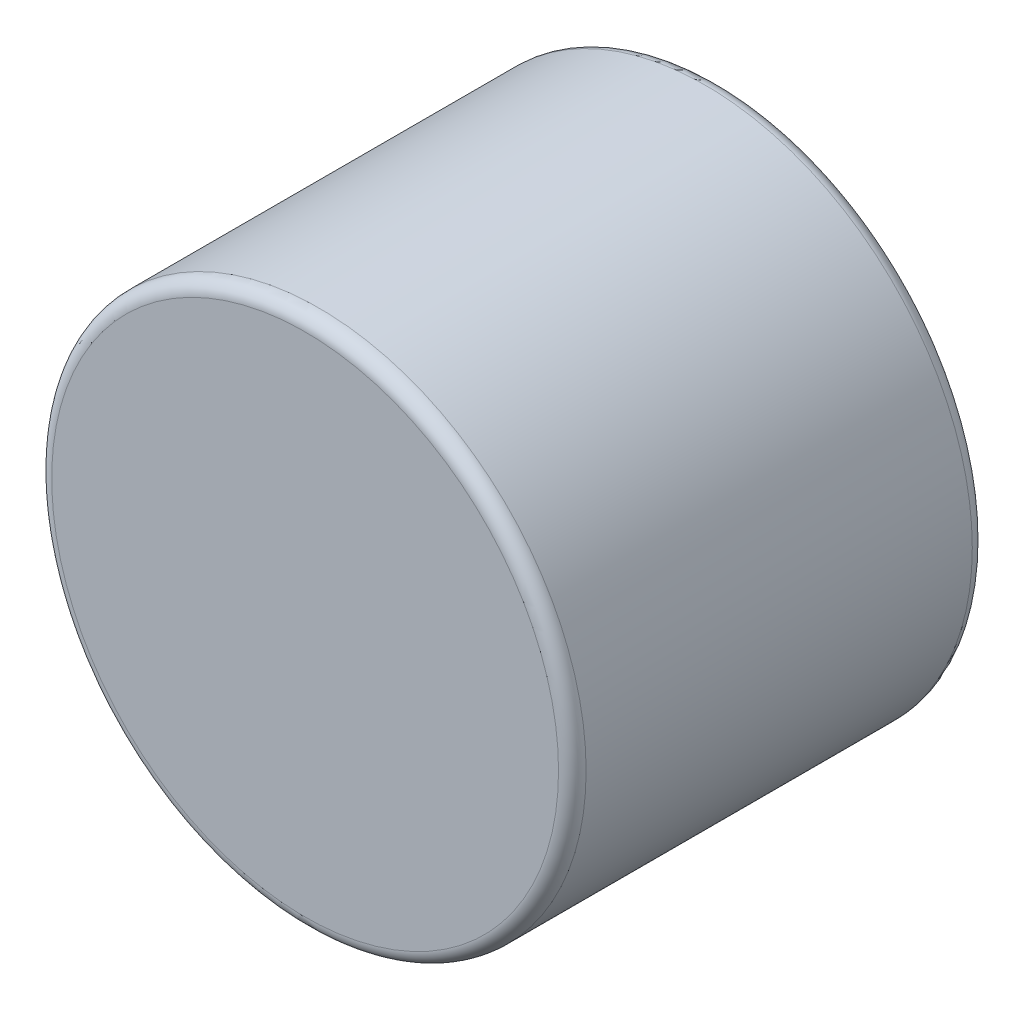
from build123d import *

# Parameters (mm, degrees)
SKETCH1_R           = 49.2125
BOSS_EXTRUDE1_DEPTH = 76.2
FILLET1_R           = 2.54


with BuildPart() as part:
    # Sketch1 → Boss-Extrude1 (new body)
    with BuildSketch(Plane.XY):
        with Locations(Location((0, 0, 0), (0, 0, 180))):
            Circle(SKETCH1_R)
    extrude(amount=BOSS_EXTRUDE1_DEPTH)

    # Fillet1
    fillet1_edges = [part.edges().sort_by_distance(p)[0] for p in [
        (49.2125, 0, 0),
        (49.2125, 0, 76.2),
    ]]
    fillet(fillet1_edges, radius=FILLET1_R)


solid = part.part
